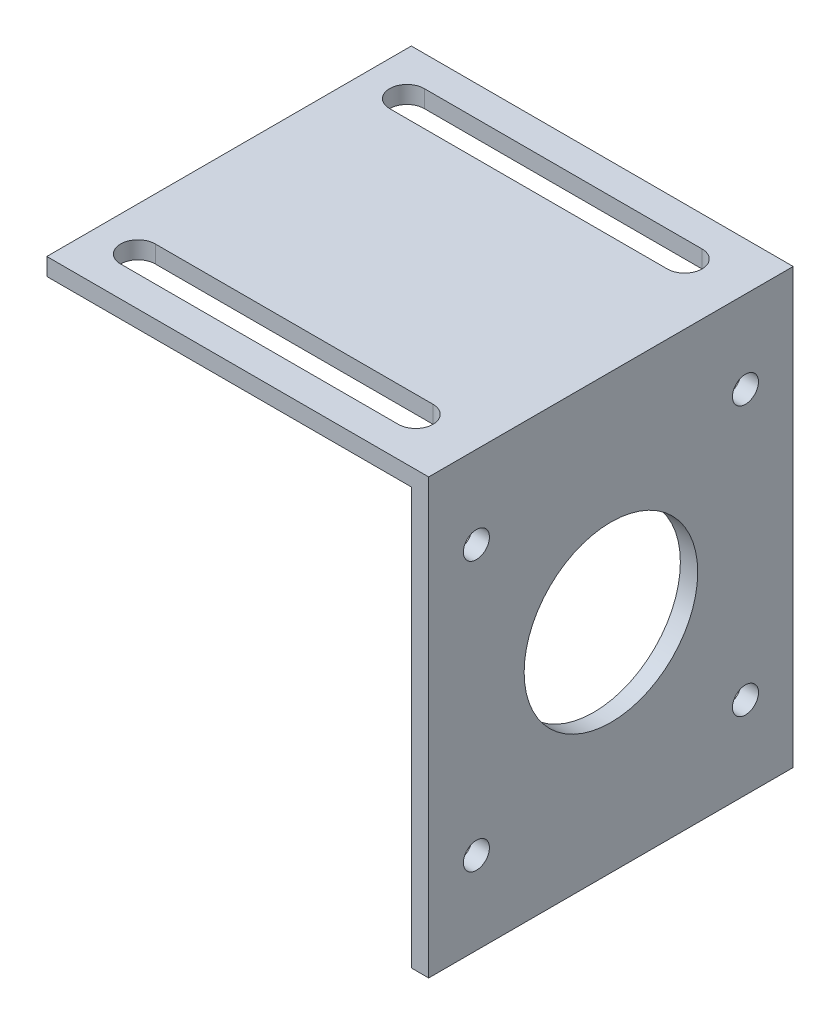
from build123d import *

# Parameters (mm, degrees)
SKETCH_2_W          = 42
SKETCH_2_H          = 50
SKETCH_2_R          = 1.5
SKETCH_2_R_2        = 10
EXTRUDE_5_DEPTH     = 2
SKETCH_4_W          = 42
SKETCH_4_H          = 42
EXTRUDE_6_DEPTH     = 25
SKETCH_4_3_W        = 42
SKETCH_4_3_H        = 42
CUT_EXTRUDE_1_DEPTH = 23


with BuildPart() as part:
    # 草图2 → 凸台-拉伸5 (new body)
    with BuildSketch(Plane(origin=(0, 0, 0), x_dir=(0, 0, -1), z_dir=(1, 0, 0))):
        Rectangle(SKETCH_2_W, SKETCH_2_H)
        with Locations((15.5, 15.5)):
            Circle(SKETCH_2_R, mode=Mode.SUBTRACT)
        with Locations((15.5, -15.5)):
            Circle(SKETCH_2_R, mode=Mode.SUBTRACT)
        with Locations((-15.5, -15.5)):
            Circle(SKETCH_2_R, mode=Mode.SUBTRACT)
        with Locations((-15.5, 15.5)):
            Circle(SKETCH_2_R, mode=Mode.SUBTRACT)
        Circle(SKETCH_2_R_2, mode=Mode.SUBTRACT)
    extrude(amount=EXTRUDE_5_DEPTH)

    # 草图4 → 凸台-拉伸6 (add)
    with BuildSketch(Plane(origin=(0, 0, 0), x_dir=(1, 0, 0), z_dir=(0, 1, 0))):
        with Locations((-21, 0)):
            Rectangle(SKETCH_4_W, SKETCH_4_H)
        with BuildLine():
            Line((-37, 17.5), (-5, 17.5))
            ThreePointArc((-5, 17.5), (-3, 15.5), (-5, 13.5))
            Line((-5, 13.5), (-37, 13.5))
            ThreePointArc((-37, 13.5), (-39, 15.5), (-37, 17.5))
        make_face(mode=Mode.SUBTRACT)
        with BuildLine():
            Line((-37, -17.5), (-5, -17.5))
            ThreePointArc((-5, -17.5), (-3, -15.5), (-5, -13.5))
            Line((-5, -13.5), (-37, -13.5))
            ThreePointArc((-37, -13.5), (-39, -15.5), (-37, -17.5))
        make_face(mode=Mode.SUBTRACT)
    extrude(amount=EXTRUDE_6_DEPTH)

    # 草图4<3> → 切除-拉伸1 (cut)
    with BuildSketch(Plane(origin=(0, 0, 0), x_dir=(1, 0, 0), z_dir=(0, 1, 0))):
        with Locations((-21, 0)):
            Rectangle(SKETCH_4_3_W, SKETCH_4_3_H)
        with BuildLine():
            Line((-37, 17.5), (-5, 17.5))
            ThreePointArc((-5, 17.5), (-3, 15.5), (-5, 13.5))
            Line((-5, 13.5), (-37, 13.5))
            ThreePointArc((-37, 13.5), (-39, 15.5), (-37, 17.5))
        make_face(mode=Mode.SUBTRACT)
        with BuildLine():
            Line((-37, -17.5), (-5, -17.5))
            ThreePointArc((-5, -17.5), (-3, -15.5), (-5, -13.5))
            Line((-5, -13.5), (-37, -13.5))
            ThreePointArc((-37, -13.5), (-39, -15.5), (-37, -17.5))
        make_face(mode=Mode.SUBTRACT)
    extrude(amount=CUT_EXTRUDE_1_DEPTH, mode=Mode.SUBTRACT)


solid = part.part
